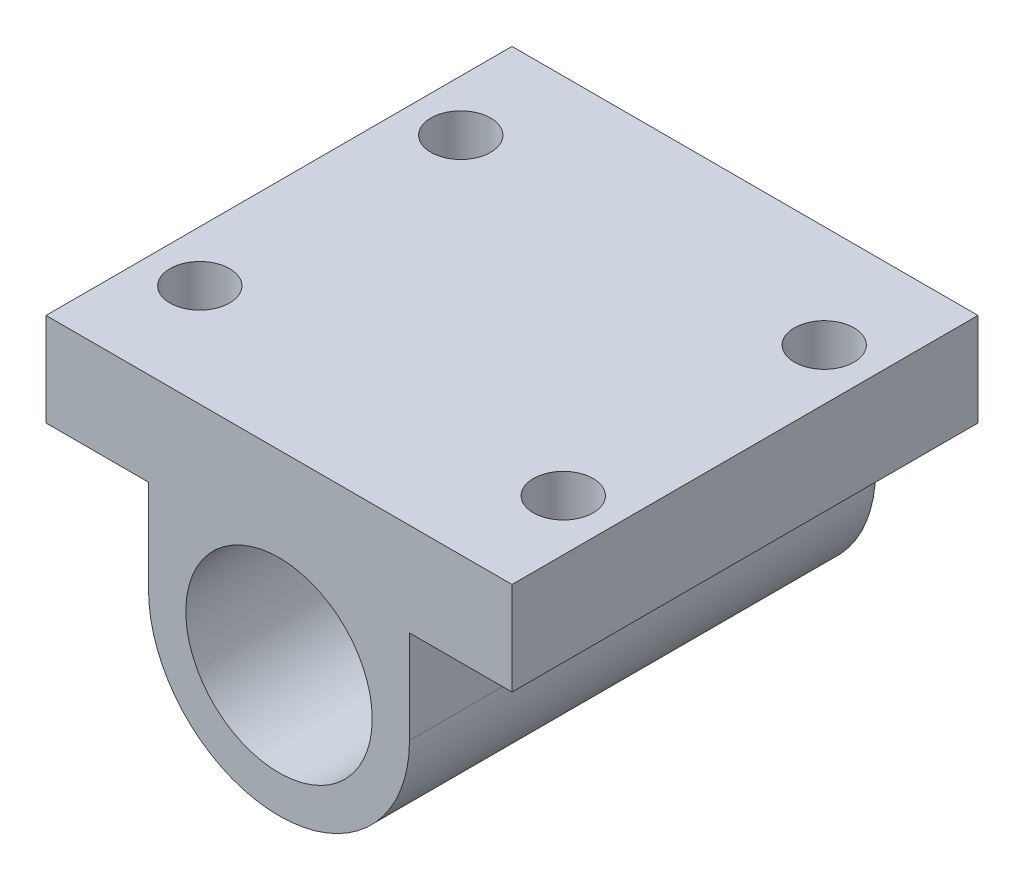
from build123d import *

# Parameters (mm, degrees)
SZKIC1_R                    = 5
DODANIE_WYCI_GNI_CIE1_DEPTH = 25
OTW_R_3_2_3_2_1_D           = 3.2
OTW_R_3_2_3_2_1_DEPTH       = 5
OTW_R_3_2_3_2_1_TIP         = 0.96137699


with BuildPart() as part:
    # Szkic1 → Dodanie-wyciągnięcie1 (new body)
    with BuildSketch(Plane.XY):
        with BuildLine():
            Line((-7, -5), (-7, 0))
            Line((-7, 0), (-12.5, 0))
            Line((-12.5, 0), (-12.5, 5))
            Line((-12.5, 5), (12.5, 5))
            Line((12.5, 5), (12.5, 0))
            Line((12.5, 0), (7, 0))
            Line((7, 0), (7, -5))
            ThreePointArc((7, -5), (0, -12), (-7, -5))
        make_face()
        with Locations((0, -5)):
            Circle(SZKIC1_R, mode=Mode.SUBTRACT)
    extrude(amount=DODANIE_WYCI_GNI_CIE1_DEPTH)

    # Otwór Ø3.2 (3.2)1
    with Locations(Plane.XZ):
        with Locations((9.75, 19.5), (-9.75, 19.5), (-9.75, 5.5), (9.75, 5.5)):
            Hole(OTW_R_3_2_3_2_1_D / 2, depth=OTW_R_3_2_3_2_1_DEPTH)
            with Locations((0, 0, -(OTW_R_3_2_3_2_1_DEPTH + OTW_R_3_2_3_2_1_TIP / 2))):  # 118° drill point
                Cone(0, OTW_R_3_2_3_2_1_D / 2, OTW_R_3_2_3_2_1_TIP, mode=Mode.SUBTRACT)


solid = part.part
